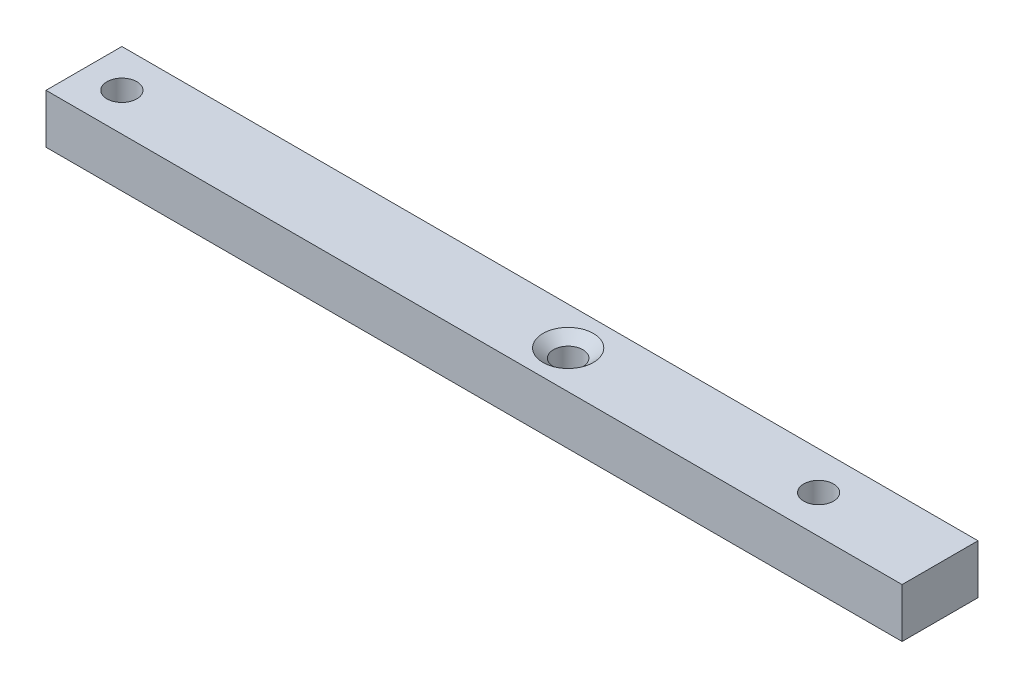
from build123d import *

# Parameters (mm, degrees)
SKETCH1_W                                         = 143.256
SKETCH1_H                                         = 12.7
BOSS_EXTRUDE1_DEPTH                               = 8.255
CSK_FOR_8_FLAT_HEAD_MACHINE_SCREW_100_D           = 4.9149
CSK_FOR_8_FLAT_HEAD_MACHINE_SCREW_100_CSINK_D     = 8.4328
CSK_FOR_8_FLAT_HEAD_MACHINE_SCREW_100_CSINK_ANGLE = 100
TAP_DRILL_FOR_2_56_TAP2_D                         = 1.778
TAP_DRILL_FOR_2_56_TAP2_DEPTH                     = 6.35
TAP_DRILL_FOR_2_56_TAP2_TIP                       = 0.53416509
TAP_DRILL_FOR_M6X1_0_TAP1_D                       = 5


with BuildPart() as part:
    # Sketch1 → Boss-Extrude1 (new body)
    with BuildSketch(Plane(origin=(0, 0, 0), x_dir=(1, 0, 0), z_dir=(0, 1, 0))):
        with Locations((7.131792208, 4.399367965)):
            Rectangle(SKETCH1_W, SKETCH1_H)
    extrude(amount=BOSS_EXTRUDE1_DEPTH)

    # CSK for #8 Flat Head Machine Screw (100)1 (through all)
    with Locations(Plane(origin=(0, 8.255, 0), x_dir=(1, 0, 0), z_dir=(0, 1, 0))):
        with Locations((16.529792208, 4.399367965)):
            CounterSinkHole(CSK_FOR_8_FLAT_HEAD_MACHINE_SCREW_100_D / 2, CSK_FOR_8_FLAT_HEAD_MACHINE_SCREW_100_CSINK_D / 2, counter_sink_angle=CSK_FOR_8_FLAT_HEAD_MACHINE_SCREW_100_CSINK_ANGLE)

    # Tap Drill for #2-56 Tap2
    with Locations(Plane(origin=(0, 0, 0), x_dir=(-1, 0, 0), z_dir=(0, -1, 0))):
        with Locations((50.027522326, 2.748367965), (40.502522326, 2.748367965)):
            Hole(TAP_DRILL_FOR_2_56_TAP2_D / 2, depth=TAP_DRILL_FOR_2_56_TAP2_DEPTH)
            with Locations((0, 0, -(TAP_DRILL_FOR_2_56_TAP2_DEPTH + TAP_DRILL_FOR_2_56_TAP2_TIP / 2))):  # 118° drill point
                Cone(0, TAP_DRILL_FOR_2_56_TAP2_D / 2, TAP_DRILL_FOR_2_56_TAP2_TIP, mode=Mode.SUBTRACT)

    # Tap Drill for M6x1.0 Tap1 (through all)
    with Locations(Plane(origin=(0, 8.255, 0), x_dir=(1, 0, 0), z_dir=(0, 1, 0))):
        with Locations((58.439792208, 4.399367965), (-58.146207792, 4.399367965)):
            Hole(TAP_DRILL_FOR_M6X1_0_TAP1_D / 2)


solid = part.part
